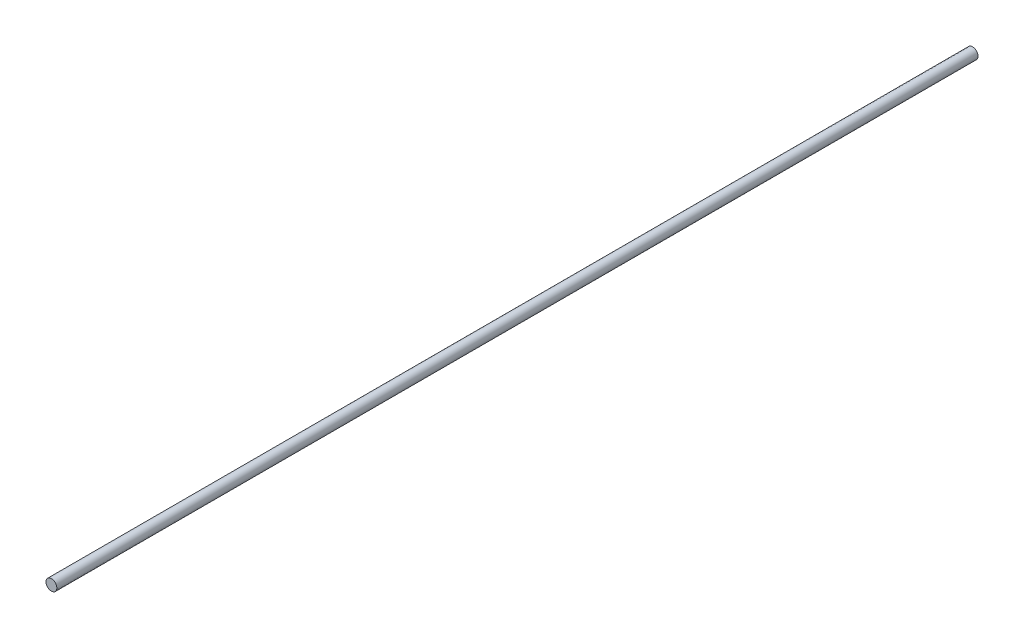
from build123d import *

# Parameters (mm, degrees)
SKETCH2_R           = 20
BOSS_EXTRUDE2_DEPTH = 3390


with BuildPart() as part:
    # Sketch2 → Boss-Extrude2 (new body)
    with BuildSketch(Plane.XY):
        with Locations((28.095709439, 18.950461736)):
            Circle(SKETCH2_R)
    extrude(amount=BOSS_EXTRUDE2_DEPTH)


solid = part.part
